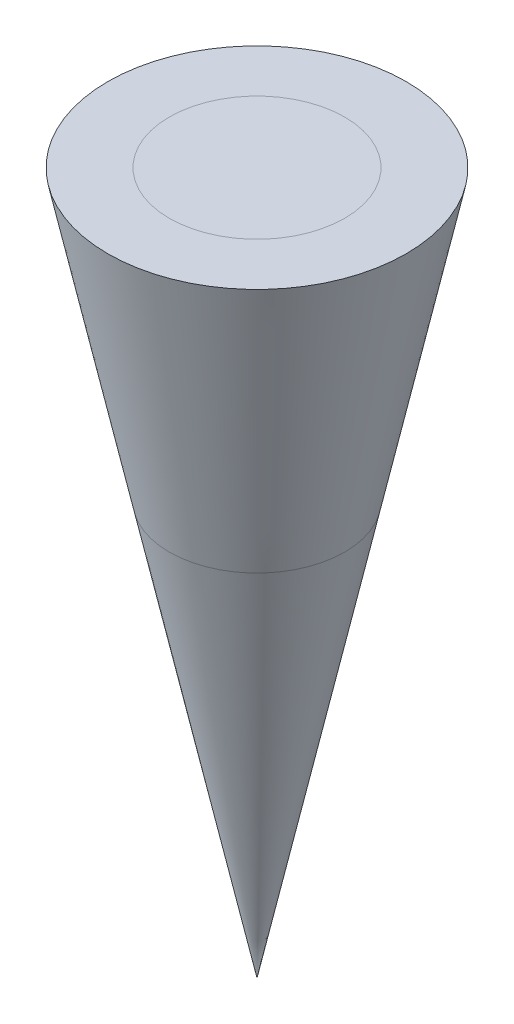
from build123d import *

# Parameters (mm, degrees)
BOSS_EXTRUDE1_DEPTH    = 10
SPLIT1_SURFACE_1_BACK  = 19.469
SPLIT1_SURFACE_1_DEPTH = 38.938
SPLIT1_SURFACE_2_BACK  = 19.469
SPLIT1_SURFACE_2_DEPTH = 38.938


with BuildPart() as part:
    # Sketch1 → Boss-Extrude1 (new body)
    with BuildSketch(Plane(origin=(0, 0, 0), x_dir=(1, 0, 0), z_dir=(0, 1, 0))):
        Polygon((5.210657733, -2.486439085), (4.758648279, 3.269342424), (-0.452009453, 5.75578151), (-5.210657733, 2.486439085), (-4.758648279, -3.269342424), (0.452009453, -5.75578151), align=None)
    extrude(amount=BOSS_EXTRUDE1_DEPTH)


with BuildPart() as body_2:
    # Split1: the piece behind the surface
    add(part.part)
    # Split1 surface: a surface, the sketch's curves swept straight by 38.938 mm
    with BuildLine(Plane(origin=(0, 10, 0), x_dir=(1, 0, 0), z_dir=(0, 1, 0)).offset(-SPLIT1_SURFACE_1_BACK), mode=Mode.PRIVATE) as split1_surface_1_path:
        CenterArc((0, 0), 1.25, 0, 360)
    split1_surface_1 = Shell.extrude(split1_surface_1_path.wire(), (0 * SPLIT1_SURFACE_1_DEPTH, 1 * SPLIT1_SURFACE_1_DEPTH, 0 * SPLIT1_SURFACE_1_DEPTH))
    split(bisect_by=split1_surface_1, keep=Keep.BOTTOM)


with BuildPart() as part_1:
    add(part.part)

    # Split1: split by a surface, the side it looks to stays
    # Split1 surface: a surface, the sketch's curves swept straight by 38.938 mm
    with BuildLine(Plane(origin=(0, 10, 0), x_dir=(1, 0, 0), z_dir=(0, 1, 0)).offset(-SPLIT1_SURFACE_2_BACK), mode=Mode.PRIVATE) as split1_surface_2_path:
        CenterArc((0, 0), 1.25, 0, 360)
    split1_surface_2 = Shell.extrude(split1_surface_2_path.wire(), (0 * SPLIT1_SURFACE_2_DEPTH, 1 * SPLIT1_SURFACE_2_DEPTH, 0 * SPLIT1_SURFACE_2_DEPTH))
    split(bisect_by=split1_surface_2, keep=Keep.TOP)


with BuildPart() as cut_revolve1_tool:
    # Sketch4 → Cut-Revolve1 (revolve)
    with BuildSketch(Plane.XY):
        Polygon((0, 0), (6.37669685, 30), (6.37669685, -2.036816597), (0, -2.036816597), align=None)
    revolve(axis=Axis((0, 0, 0), (0, 1, 0)))


with BuildPart() as part_2:
    add(part_1.part)

    # Cut-Revolve1: cut by cut_revolve1_tool
    add(cut_revolve1_tool.part, mode=Mode.SUBTRACT)


with BuildPart() as body_2_1:
    add(body_2.part)

    # Cut-Revolve1: cut by cut_revolve1_tool
    add(cut_revolve1_tool.part, mode=Mode.SUBTRACT)


solid = Compound([part_2.part, body_2_1.part])
